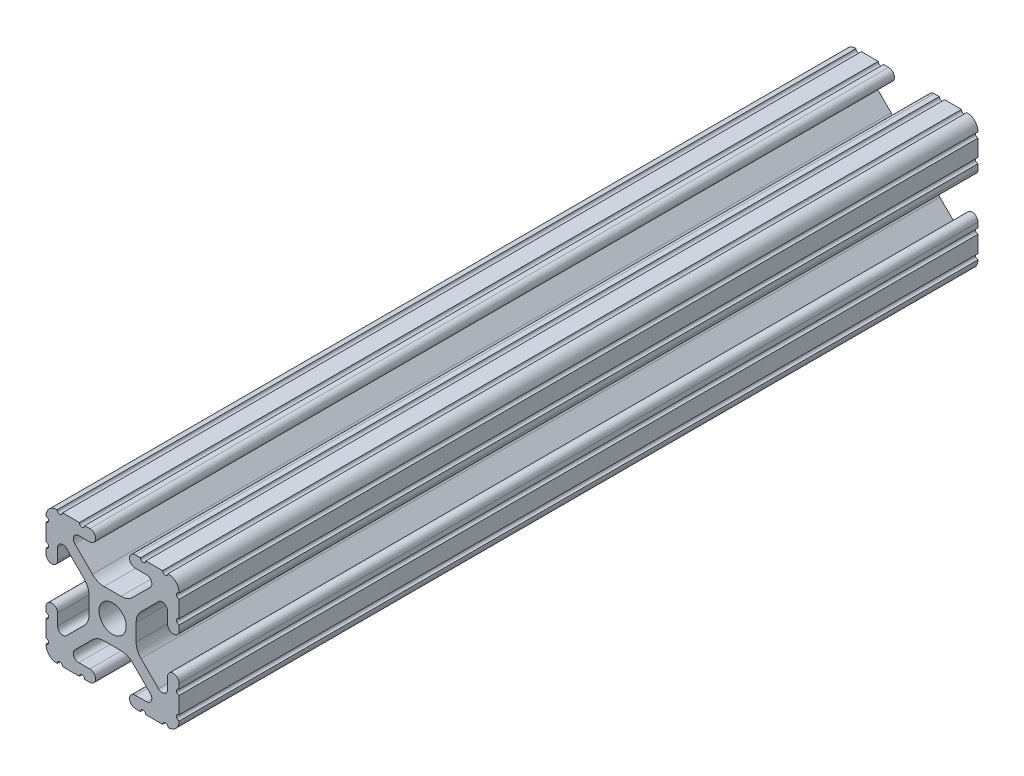
from build123d import *

# Parameters (mm, degrees)
SKETCH1_R           = 2.6035
BOSS_EXTRUDE1_DEPTH = 152.4


with BuildPart() as part:
    # Sketch1 → Boss-Extrude1 (new body)
    with BuildSketch(Plane(origin=(0, 0, -25.4), x_dir=(-1, 0, 0), z_dir=(0, 0, -1))):
        with BuildLine():
            Line((12.7, -9.5504), (12.7, -6.3330836))
            ThreePointArc((12.7, -6.3330836), (12.192, -5.8250836), (12.7, -5.3170836))
            Line((12.7, -5.3170836), (12.7, -4.3434))
            ThreePointArc((12.7, -4.3434), (11.5951, -3.2385), (10.4902, -4.3434))
            Line((10.4902, -4.3434), (10.4902, -6.474794456))
            ThreePointArc((10.4902, -6.474794456), (9.863006367, -7.413456061), (8.75577951, -7.193214945))
            Line((8.75577951, -7.193214945), (5.42573597, -3.863171405))
            ThreePointArc((5.42573597, -3.863171405), (4.737482484, -2.833127272), (4.4958, -1.618107374))
            Line((4.4958, -1.618107374), (4.4958, 1.618107374))
            ThreePointArc((4.4958, 1.618107374), (4.737482484, 2.833127272), (5.42573597, 3.863171405))
            Line((5.42573597, 3.863171405), (8.75577951, 7.193214945))
            ThreePointArc((8.75577951, 7.193214945), (9.863006367, 7.413456061), (10.4902, 6.474794456))
            Line((10.4902, 6.474794456), (10.4902, 4.343399971))
            ThreePointArc((10.4902, 4.343399971), (11.5951, 3.238499971), (12.7, 4.343399971))
            Line((12.7, 4.343399971), (12.7, 5.3170836))
            ThreePointArc((12.7, 5.3170836), (12.192, 5.8250836), (12.7, 6.3330836))
            Line((12.7, 6.3330836), (12.7, 9.5504))
            ThreePointArc((12.7, 9.5504), (12.192000006, 10.058323491), (12.699846982, 10.566399977))
            ThreePointArc((12.699846982, 10.566399977), (12.082522516, 12.082522516), (10.566399977, 12.699846982))
            ThreePointArc((10.566399977, 12.699846982), (10.058323491, 12.192000006), (9.5504, 12.7))
            Line((9.5504, 12.7), (6.3330836, 12.7))
            ThreePointArc((6.3330836, 12.7), (5.8250836, 12.192), (5.3170836, 12.7))
            Line((5.3170836, 12.7), (4.3434, 12.7))
            ThreePointArc((4.3434, 12.7), (3.2385, 11.5951), (4.3434, 10.4902))
            Line((4.3434, 10.4902), (6.474794456, 10.4902))
            ThreePointArc((6.474794456, 10.4902), (7.413456061, 9.863006367), (7.193214945, 8.75577951))
            Line((7.193214945, 8.75577951), (3.863171405, 5.42573597))
            ThreePointArc((3.863171405, 5.42573597), (2.833127272, 4.737482484), (1.618107374, 4.4958))
            Line((1.618107374, 4.4958), (-1.618107374, 4.4958))
            ThreePointArc((-1.618107374, 4.4958), (-2.833127272, 4.737482484), (-3.863171405, 5.42573597))
            Line((-3.863171405, 5.42573597), (-7.193214945, 8.75577951))
            ThreePointArc((-7.193214945, 8.75577951), (-7.413456061, 9.863006367), (-6.474794456, 10.4902))
            Line((-6.474794456, 10.4902), (-4.343399971, 10.4902))
            ThreePointArc((-4.343399971, 10.4902), (-3.238499971, 11.5951), (-4.343399971, 12.7))
            Line((-4.343399971, 12.7), (-5.3170836, 12.7))
            ThreePointArc((-5.3170836, 12.7), (-5.8250836, 12.192), (-6.3330836, 12.7))
            Line((-6.3330836, 12.7), (-9.5504, 12.7))
            ThreePointArc((-9.5504, 12.7), (-10.058323491, 12.192000006), (-10.566399977, 12.699846982))
            ThreePointArc((-10.566399977, 12.699846982), (-12.082522516, 12.082522516), (-12.699846982, 10.566399977))
            ThreePointArc((-12.699846982, 10.566399977), (-12.192000006, 10.058323491), (-12.7, 9.5504))
            Line((-12.7, 9.5504), (-12.7, 6.3330836))
            ThreePointArc((-12.7, 6.3330836), (-12.192, 5.8250836), (-12.7, 5.3170836))
            Line((-12.7, 5.3170836), (-12.7, 4.3434))
            ThreePointArc((-12.7, 4.3434), (-11.5951, 3.2385), (-10.4902, 4.3434))
            Line((-10.4902, 4.3434), (-10.4902, 6.474794456))
            ThreePointArc((-10.4902, 6.474794456), (-9.863006367, 7.413456061), (-8.75577951, 7.193214945))
            Line((-8.75577951, 7.193214945), (-5.42573597, 3.863171405))
            ThreePointArc((-5.42573597, 3.863171405), (-4.737482484, 2.833127272), (-4.4958, 1.618107374))
            Line((-4.4958, 1.618107374), (-4.4958, -1.618107374))
            ThreePointArc((-4.4958, -1.618107374), (-4.737482484, -2.833127272), (-5.42573597, -3.863171405))
            Line((-5.42573597, -3.863171405), (-8.75577951, -7.193214945))
            ThreePointArc((-8.75577951, -7.193214945), (-9.863006367, -7.413456061), (-10.4902, -6.474794456))
            Line((-10.4902, -6.474794456), (-10.4902, -4.343399971))
            ThreePointArc((-10.4902, -4.343399971), (-11.5951, -3.238499971), (-12.7, -4.343399971))
            Line((-12.7, -4.343399971), (-12.7, -5.3170836))
            ThreePointArc((-12.7, -5.3170836), (-12.192, -5.8250836), (-12.7, -6.3330836))
            Line((-12.7, -6.3330836), (-12.7, -9.5504))
            ThreePointArc((-12.7, -9.5504), (-12.192000006, -10.058323491), (-12.699846982, -10.566399977))
            ThreePointArc((-12.699846982, -10.566399977), (-12.082522516, -12.082522516), (-10.566399977, -12.699846982))
            ThreePointArc((-10.566399977, -12.699846982), (-10.058323491, -12.192000006), (-9.5504, -12.7))
            Line((-9.5504, -12.7), (-6.3330836, -12.7))
            ThreePointArc((-6.3330836, -12.7), (-5.8250836, -12.192), (-5.3170836, -12.7))
            Line((-5.3170836, -12.7), (-4.3434, -12.7))
            ThreePointArc((-4.3434, -12.7), (-3.2385, -11.5951), (-4.3434, -10.4902))
            Line((-4.3434, -10.4902), (-6.474794456, -10.4902))
            ThreePointArc((-6.474794456, -10.4902), (-7.413456061, -9.863006367), (-7.193214945, -8.75577951))
            Line((-7.193214945, -8.75577951), (-3.863171405, -5.42573597))
            ThreePointArc((-3.863171405, -5.42573597), (-2.833127272, -4.737482484), (-1.618107374, -4.4958))
            Line((-1.618107374, -4.4958), (1.618107374, -4.4958))
            ThreePointArc((1.618107374, -4.4958), (2.833127272, -4.737482484), (3.863171405, -5.42573597))
            Line((3.863171405, -5.42573597), (7.193214945, -8.75577951))
            ThreePointArc((7.193214945, -8.75577951), (7.413456061, -9.863006367), (6.474794456, -10.4902))
            Line((6.474794456, -10.4902), (4.343399971, -10.4902))
            ThreePointArc((4.343399971, -10.4902), (3.238499971, -11.5951), (4.343399971, -12.7))
            Line((4.343399971, -12.7), (5.3170836, -12.7))
            ThreePointArc((5.3170836, -12.7), (5.8250836, -12.192), (6.3330836, -12.7))
            Line((6.3330836, -12.7), (9.5504, -12.7))
            ThreePointArc((9.5504, -12.7), (10.058323491, -12.192000006), (10.566399977, -12.699846982))
            ThreePointArc((10.566399977, -12.699846982), (12.082522516, -12.082522516), (12.699846982, -10.566399977))
            ThreePointArc((12.699846982, -10.566399977), (12.192000006, -10.058323491), (12.7, -9.5504))
        make_face()
        Circle(SKETCH1_R, mode=Mode.SUBTRACT)
    extrude(amount=-BOSS_EXTRUDE1_DEPTH)


solid = part.part
